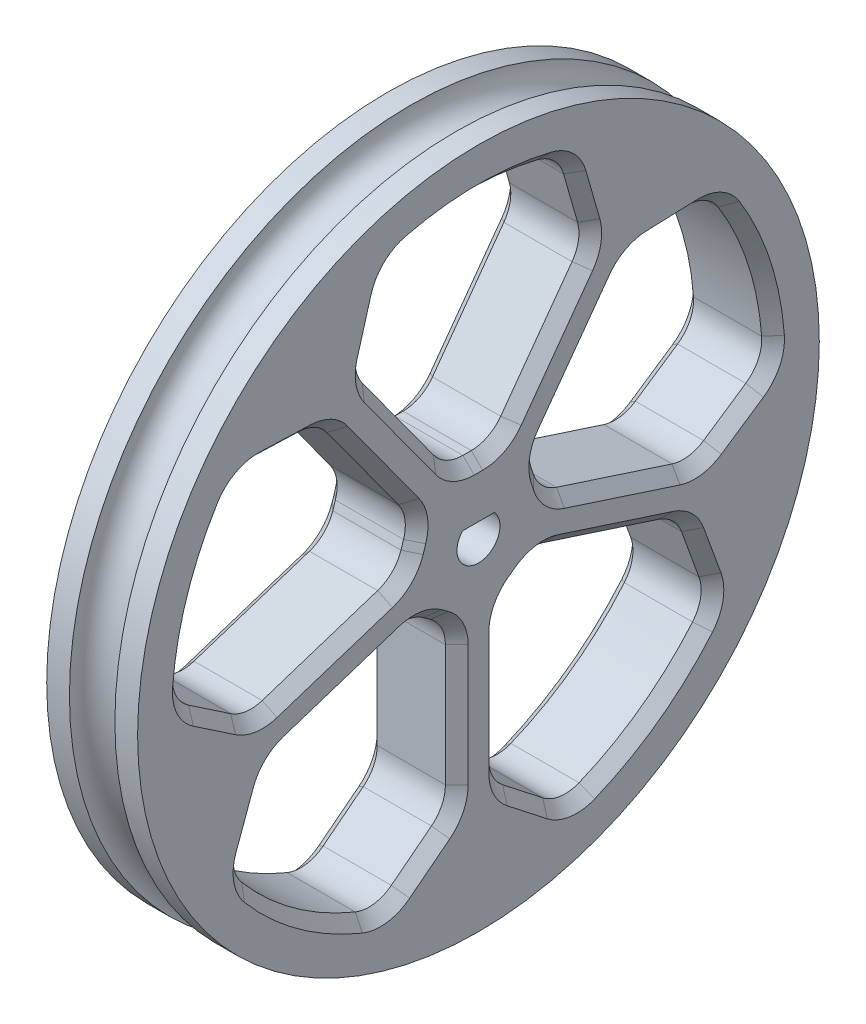
from build123d import *

# Parameters (mm, degrees)
CUT_EXTRUDE1_REACH             = 35.825
CUT_EXTRUDE1_DIRECTION_2_REACH = 35.825
CUT_EXTRUDE2_REACH             = 35.825
CUT_EXTRUDE2_DIRECTION_2_REACH = 35.825
FILLET1_R                      = 2.54
CHAMFER1_SIZE                  = 0.79375
CIRPATTERN3_COUNT              = 5
FILLET1_OF_CIRPATTERN3_R       = 2.54
CHAMFER1_OF_CIRPATTERN3_SIZE   = 0.79375


with BuildPart() as part:
    # Sketch1 → Revolve1 (revolve)
    with BuildSketch(Plane.XY):
        with BuildLine():
            Line((-3.175000000000003, 23.8125), (-1.5875, 23.8125))
            ThreePointArc((-1.5875, 23.8125), (-2.9e-16, 22.225), (1.5875, 23.8125))
            Line((1.5875, 23.8125), (3.175000000000003, 23.8125))
            Line((3.175000000000003, 23.8125), (3.175000000000018, 0))
            Line((3.175000000000018, 0), (-3.175000000000018, 0))
            Line((-3.175000000000018, 0), (-3.175000000000003, 23.8125))
        make_face()
    revolve(axis=Axis((-3.175000000000018, 0, 0), (1, 0, 0)))

    # Cut-Extrude1: up to this face of the body (flat: up to its plane)
    cut_extrude1_end = Plane(part.part.faces().sort_by_distance((3.175, 0, 0))[0])
    # Sketch3 → Cut-Extrude1 (cut, up to the picked face)
    with BuildSketch(Plane(origin=(0, 0, 0), x_dir=(0, 0, -1), z_dir=(1, 0, 0)), mode=Mode.PRIVATE) as cut_extrude1_sk1:
        with BuildLine():
            Line((8.060345380986481, 13.671607356395112), (6.35, 19.636290542004108))
            ThreePointArc((6.3500000000000005, 19.636290542004108), (-1.78e-15, 20.63749999999998), (-6.350000000000003, 19.636290542004108))
            Line((-6.35, 19.636290542004108), (-8.060345380986481, 13.67160735639511))
            Line((-8.060345380986481, 13.67160735639511), (-1.587499999999998, 4.762499999999999))
            Line((-1.587499999999998, 4.762499999999999), (1.587500000000002, 4.762499999999999))
            Line((1.5875000000000012, 4.762499999999999), (8.060345380986481, 13.671607356395112))
        make_face()
    cut_extrude1_tool1 = split(extrude(cut_extrude1_sk1.sketch, amount=CUT_EXTRUDE1_REACH, mode=Mode.PRIVATE), bisect_by=cut_extrude1_end, keep=Keep.BOTH, mode=Mode.PRIVATE)
    cut_extrude1 = cut_extrude1_tool1.solids().sort_by(Axis((0, 13.689196, 0), (1, 0, 0)))[0]
    add(cut_extrude1, mode=Mode.SUBTRACT)

    # Cut-Extrude1 direction 2: up to this face of the body (flat: up to its plane)
    cut_extrude1_direction_2_end = Plane(part.part.faces().sort_by_distance((-3.175, 0, 0))[0])
    # Sketch3 → Cut-Extrude1 direction 2 (cut, up to the picked face)
    with BuildSketch(Plane(origin=(0, 0, 0), x_dir=(0, 0, -1), z_dir=(1, 0, 0)), mode=Mode.PRIVATE) as cut_extrude1_direction_2_sk1:
        with BuildLine():
            Line((8.060345380986481, 13.671607356395112), (6.35, 19.636290542004108))
            ThreePointArc((6.3500000000000005, 19.636290542004108), (-1.78e-15, 20.63749999999998), (-6.350000000000003, 19.636290542004108))
            Line((-6.35, 19.636290542004108), (-8.060345380986481, 13.67160735639511))
            Line((-8.060345380986481, 13.67160735639511), (-1.587499999999998, 4.762499999999999))
            Line((-1.587499999999998, 4.762499999999999), (1.587500000000002, 4.762499999999999))
            Line((1.5875000000000012, 4.762499999999999), (8.060345380986481, 13.671607356395112))
        make_face()
    cut_extrude1_direction_2_tool1 = split(extrude(cut_extrude1_direction_2_sk1.sketch, amount=-CUT_EXTRUDE1_DIRECTION_2_REACH, mode=Mode.PRIVATE), bisect_by=cut_extrude1_direction_2_end, keep=Keep.BOTH, mode=Mode.PRIVATE)
    cut_extrude1_direction_2 = cut_extrude1_direction_2_tool1.solids().sort_by(Axis((0, 13.689196, 0), (-1, 0, 0)))[0]
    add(cut_extrude1_direction_2, mode=Mode.SUBTRACT)

    # Sketch3<3> → Cut-Extrude2 (cut, up to next)
    with BuildSketch(Plane(origin=(0, 0, 0), x_dir=(0, 0, -1), z_dir=(1, 0, 0)), mode=Mode.PRIVATE) as cut_extrude2_sk1:
        with BuildLine():
            Line((1.1180339887499005, 1), (-1.1180339887498951, 0.9999999999999998))
            ThreePointArc((-1.1180339887498951, 0.9999999999999998), (-2.94e-15, -1.5), (1.1180339887499005, 1))
        make_face()
    cut_extrude2_tool1 = extrude(cut_extrude2_sk1.sketch, amount=CUT_EXTRUDE2_REACH, mode=Mode.PRIVATE) & part.part
    add(cut_extrude2_tool1.solids().sort_by_distance((0, -0.148024, 0))[0], mode=Mode.SUBTRACT)

    # Sketch3<3> → Cut-Extrude2 direction 2 (cut, up to next)
    with BuildSketch(Plane(origin=(0, 0, 0), x_dir=(0, 0, -1), z_dir=(1, 0, 0)), mode=Mode.PRIVATE) as cut_extrude2_direction_2_sk1:
        with BuildLine():
            Line((1.1180339887499005, 1), (-1.1180339887498951, 0.9999999999999998))
            ThreePointArc((-1.1180339887498951, 0.9999999999999998), (-2.94e-15, -1.5), (1.1180339887499005, 1))
        make_face()
    cut_extrude2_direction_2_tool1 = extrude(cut_extrude2_direction_2_sk1.sketch, amount=-CUT_EXTRUDE2_DIRECTION_2_REACH, mode=Mode.PRIVATE) & part.part
    add(cut_extrude2_direction_2_tool1.solids().sort_by_distance((0, -0.148024, 0))[0], mode=Mode.SUBTRACT)

    # Fillet1
    fillet1_edges = [part.edges().sort_by_distance(p)[0] for p in [
        (-7.55e-15, 19.636290542004108, 6.3500000000000005),
        (-7.55e-15, 13.67160735639511, 8.060345380986481),
        (-7.55e-15, 4.762499999999999, 1.587499999999998),
        (-7.55e-15, 4.762499999999999, -1.5875000000000017),
        (-7.55e-15, 13.671607356395112, -8.060345380986481),
        (-7.55e-15, 19.636290542004108, -6.35),
    ]]
    fillet(fillet1_edges, radius=FILLET1_R)

    # Chamfer1
    chamfer1_edges = [part.edges().sort_by_distance(p)[0] for p in [
        (-3.175000000000018, 16.571235697108996, -7.228890333871329),
        (-3.175000000000018, 20.63749999999998, 4.4e-16),
        (-3.1750000000000185, 16.571235697108996, 7.2288903338713295),
        (-3.1750000000000185, 9.239444787653579, 4.840190783762263),
        (-3.175000000000018, 4.762499999999999, -2.33e-15),
        (-3.1750000000000185, 9.239444787653582, -4.840190783762267),
        (3.1750000000000034, 9.239444787653582, -4.840190783762266),
        (3.175000000000003, 4.762499999999999, -2.33e-15),
        (3.1750000000000034, 9.239444787653579, 4.840190783762263),
        (3.1750000000000034, 16.571235697108996, 7.2288903338713295),
        (3.175000000000003, 20.63749999999998, 1.11e-14),
        (3.175000000000003, 16.571235697108996, -7.228890333871329),
        (3.175000000000003, 5.039343428561543, 1.4464412276225966),
        (3.175000000000003, 13.721272285678912, 7.778681570466657),
        (3.175000000000003, 5.039343428561544, -1.4464412276226006),
        (3.175000000000003, 19.41107434572663, 6.057523546011634),
        (3.175000000000003, 13.72127228567892, -7.778681570466657),
        (3.175000000000003, 19.411074345726625, -6.057523546011632),
        (-3.175000000000018, 5.039343428561543, 1.4464412276225966),
        (-3.175000000000018, 5.039343428561544, -1.4464412276226006),
        (-3.175000000000018, 13.721272285678912, 7.778681570466657),
        (-3.175000000000018, 13.721272285678918, -7.778681570466657),
        (-3.175000000000018, 19.41107434572663, 6.057523546011634),
        (-3.175000000000018, 19.411074345726625, -6.057523546011634),
    ]]
    chamfer(chamfer1_edges, length=CHAMFER1_SIZE)

    # CirPattern3: Cut-Extrude1, Cut-Extrude1 direction 2 ×5 about axis
    cirpattern3_axis = Axis((-1.5875, 0, 0), (-1, 0, 0))
    add([cut_extrude1.rotate(cirpattern3_axis, i * 360 / CIRPATTERN3_COUNT) for i in range(1, CIRPATTERN3_COUNT)], mode=Mode.SUBTRACT)
    add([cut_extrude1_direction_2.rotate(cirpattern3_axis, i * 360 / CIRPATTERN3_COUNT) for i in range(1, CIRPATTERN3_COUNT)], mode=Mode.SUBTRACT)

    # Fillet1 of CirPattern3
    fillet1_of_cirpattern3_edges = [part.edges().sort_by_distance(p)[0] for p in [
        (-7.55e-15, 12.107156362437543, -16.712964161556982),
        (-7.55e-15, 11.890603011724373, -10.511687561271895),
        (-7.55e-15, 2.9814956553292413, -4.038842180285439),
        (-7.55e-15, -0.03810878390787087, -5.019971137425897),
        (-7.55e-15, -3.4410849846290965, -15.493254967784763),
        (-7.55e-15, 0.02873860548909324, -20.637479990118813),
        (-7.55e-15, -12.153656402908165, -16.679179904601106),
        (-7.55e-15, -6.322810548417581, -14.556925572972006),
        (-7.55e-15, -2.919834347696386, -4.08364174261313),
        (-7.55e-15, -4.7860525237249885, -1.5150127854726732),
        (-7.55e-15, -15.798314835072805, -1.5150127854726616),
        (-7.55e-15, -19.618529107022574, -6.404664076039276),
        (-7.77e-15, -19.618529107022578, 6.4046640760392695),
        (-7.77e-15, -15.798314835072805, 1.5150127854726563),
        (-7.77e-15, -4.786052523724987, 1.515012785472675),
        (-7.77e-15, -2.9198343476963853, 4.083641742613133),
        (-7.77e-15, -6.322810548417588, 14.556925572972006),
        (-7.77e-15, -12.153656402908169, 16.679179904601103),
        (-7.55e-15, 0.02873860548908702, 20.637479990118816),
        (-7.55e-15, -3.441084984629101, 15.493254967784761),
        (-7.55e-15, -0.03810878390786843, 5.019971137425896),
        (-7.55e-15, 2.981495655329244, 4.038842180285439),
        (-7.55e-15, 11.890603011724371, 10.511687561271899),
        (-7.55e-15, 12.10715636243754, 16.712964161556986),
    ]]
    fillet(fillet1_of_cirpattern3_edges, radius=FILLET1_OF_CIRPATTERN3_R)

    # Chamfer1 of CirPattern3
    chamfer1_of_cirpattern3_edges = [part.edges().sort_by_distance(p)[0] for p in [
        (-3.175000000000018, -1.7542898094119161, -17.9940316564374),
        (-3.175000000000018, 6.377338221412972, -19.627428855041213),
        (-3.1750000000000185, 11.995876705810835, -13.526331729159342),
        (-3.1750000000000185, 7.45844044298283, -7.291532964047692),
        (-3.175000000000018, 1.4716934357106848, -4.5294066588556685),
        (-3.1750000000000185, -1.7481495270348661, -10.282935380446766),
        (3.1750000000000034, -1.7481495270348653, -10.282935380446766),
        (3.175000000000003, 1.4716934357106848, -4.5294066588556685),
        (3.1750000000000034, 7.45844044298283, -7.291532964047692),
        (3.1750000000000034, 11.995876705810835, -13.526331729159342),
        (3.175000000000003, 6.377338221412983, -19.62742885504121),
        (3.175000000000003, -1.7542898094119161, -17.9940316564374),
        (3.175000000000003, 2.9328901148856628, -4.3457254848826725),
        (3.175000000000003, 11.638072116498094, -10.645960620049623),
        (3.175000000000003, 0.18159540494879534, -5.239675326282563),
        (3.175000000000003, 11.759399092950783, -16.589151025249006),
        (3.175000000000003, -3.1578594750565667, -15.453450218260434),
        (3.175000000000003, 0.23730461085940302, -20.33290646433698),
        (-3.175000000000018, 2.9328901148856628, -4.3457254848826725),
        (-3.175000000000018, 0.18159540494879534, -5.239675326282563),
        (-3.175000000000018, 11.638072116498094, -10.645960620049623),
        (-3.175000000000018, -3.1578594750565676, -15.453450218260432),
        (-3.175000000000018, 11.759399092950783, -16.589151025249006),
        (-3.175000000000018, 0.23730461085940124, -20.33290646433698),
        (-3.175000000000018, -17.655446425443134, -3.8920328244485587),
        (-3.175000000000018, -16.69608822141296, -12.130418144185906),
        (-3.1750000000000185, -9.157376168064776, -15.588623085597943),
        (-3.1750000000000185, -4.629875090823367, -9.346605985634003),
        (-3.175000000000018, -3.8529434357106873, -2.7993272640429017),
        (-3.1750000000000185, -10.319860612778182, -1.5150127854726674),
        (3.1750000000000034, -10.319860612778182, -1.5150127854726683),
        (3.175000000000003, -3.8529434357106873, -2.7993272640429017),
        (3.1750000000000034, -4.629875090823367, -9.346605985634003),
        (3.1750000000000034, -9.157376168064776, -15.588623085597943),
        (3.175000000000003, -16.696088221412953, -12.130418144185915),
        (3.175000000000003, -17.655446425443134, -3.8920328244485587),
        (3.175000000000003, -3.2267176522936194, -4.1322472830567065),
        (3.175000000000003, -6.528548154160662, -14.35824707655023),
        (3.175000000000003, -4.927111296102388, -1.7918562140342191),
        (3.175000000000003, -12.14336601900836, -16.310182724120686),
        (3.175000000000003, -15.67293677295978, -1.7720759078727752),
        (3.175000000000003, -19.264412030528447, -6.5089037390210756),
        (-3.175000000000018, -3.2267176522936194, -4.1322472830567065),
        (-3.175000000000018, -4.927111296102388, -1.7918562140342191),
        (-3.175000000000018, -6.528548154160662, -14.35824707655023),
        (-3.175000000000018, -15.672936772959778, -1.7720759078727735),
        (-3.175000000000018, -12.14336601900836, -16.310182724120686),
        (-3.175000000000018, -19.264412030528447, -6.508903739021074),
        (-3.1750000000000176, -9.15737616806478, 15.588623085597941),
        (-3.1750000000000176, -16.696088221412964, 12.130418144185901),
        (-3.1750000000000185, -17.655446425443138, 3.8920328244485525),
        (-3.1750000000000185, -10.319860612778179, 1.5150127854726656),
        (-3.1750000000000176, -3.852943435710686, 2.7993272640429043),
        (-3.1750000000000185, -4.6298750908233695, 9.346605985634007),
        (3.1750000000000025, -4.62987509082337, 9.346605985634007),
        (3.1750000000000025, -3.852943435710686, 2.7993272640429043),
        (3.1750000000000025, -10.319860612778179, 1.5150127854726656),
        (3.1750000000000025, -17.655446425443138, 3.8920328244485525),
        (3.1750000000000025, -16.69608822141297, 12.130418144185892),
        (3.1750000000000025, -9.15737616806478, 15.588623085597941),
        (3.1750000000000025, -4.927111296102385, 1.7918562140342202),
        (3.1750000000000025, -15.672936772959774, 1.7720759078727664),
        (3.1750000000000025, -3.226717652293619, 4.132247283056709),
        (3.1750000000000025, -19.264412030528455, 6.508903739021071),
        (3.1750000000000025, -6.5285481541606725, 14.358247076550233),
        (3.1750000000000025, -12.143366019008363, 16.31018272412068),
        (-3.1750000000000176, -4.927111296102385, 1.7918562140342202),
        (-3.1750000000000176, -3.226717652293619, 4.132247283056709),
        (-3.1750000000000176, -15.672936772959774, 1.7720759078727664),
        (-3.1750000000000176, -6.528548154160671, 14.358247076550233),
        (-3.1750000000000176, -19.264412030528455, 6.508903739021071),
        (-3.1750000000000176, -12.143366019008361, 16.310182724120683),
        (-3.175000000000018, 11.995876705810831, 13.526331729159349),
        (-3.175000000000018, 6.377338221412968, 19.627428855041217),
        (-3.1750000000000185, -1.7542898094119215, 17.9940316564374),
        (-3.1750000000000185, -1.7481495270348657, 10.282935380446762),
        (-3.175000000000018, 1.4716934357106881, 4.529406658855668),
        (-3.1750000000000185, 7.458440442982834, 7.291532964047695),
        (3.1750000000000034, 7.458440442982833, 7.291532964047695),
        (3.175000000000003, 1.4716934357106881, 4.529406658855668),
        (3.1750000000000034, -1.7481495270348657, 10.282935380446762),
        (3.1750000000000034, -1.7542898094119215, 17.9940316564374),
        (3.175000000000003, 6.377338221412957, 19.62742885504122),
        (3.175000000000003, 11.995876705810831, 13.526331729159349),
        (3.175000000000003, 0.18159540494879756, 5.239675326282561),
        (3.175000000000003, -3.157859475056573, 15.453450218260427),
        (3.175000000000003, 2.932890114885666, 4.3457254848826725),
        (3.175000000000003, 0.2373046108593977, 20.332906464336986),
        (3.175000000000003, 11.638072116498094, 10.645960620049634),
        (3.175000000000003, 11.759399092950776, 16.589151025249006),
        (-3.175000000000018, 0.18159540494879756, 5.239675326282561),
        (-3.175000000000018, 2.932890114885666, 4.3457254848826725),
        (-3.175000000000018, -3.157859475056573, 15.453450218260427),
        (-3.175000000000018, 11.638072116498094, 10.645960620049632),
        (-3.175000000000018, 0.2373046108593977, 20.332906464336986),
        (-3.175000000000018, 11.759399092950778, 16.589151025249006),
    ]]
    chamfer(chamfer1_of_cirpattern3_edges, length=CHAMFER1_OF_CIRPATTERN3_SIZE)


solid = part.part
